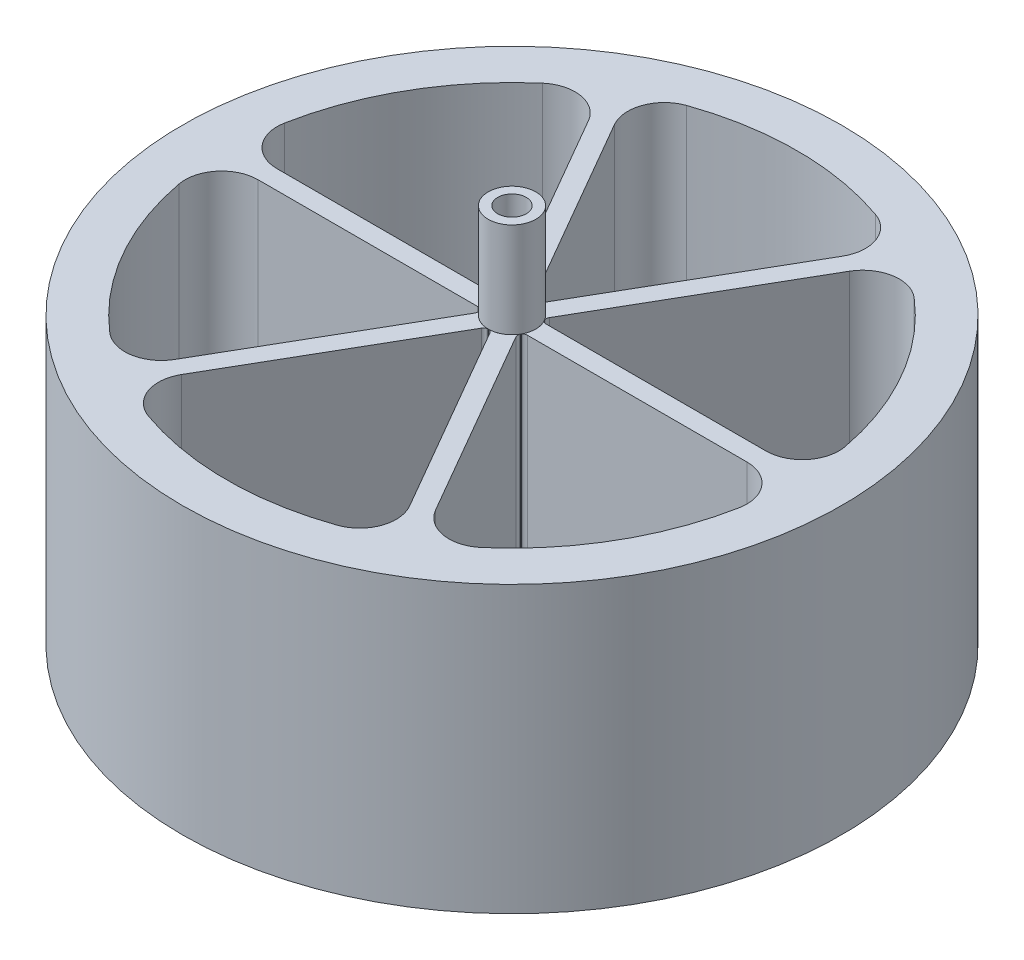
from build123d import *

# Parameters (mm, degrees)
SKETCH1_R             = 2.5
SKETCH1_R_2           = 1.5
BOSS_EXTRUDE1_DEPTH   = 10
BOSS_EXTRUDE3_DEPTH   = 30
BOSS_EXTRUDE3_2_DEPTH = 30
BOSS_EXTRUDE3_3_DEPTH = 30
BOSS_EXTRUDE3_4_DEPTH = 30
BOSS_EXTRUDE3_5_DEPTH = 30
BOSS_EXTRUDE3_6_DEPTH = 30
SKETCH5_R             = 34.666608733
SKETCH5_R_2           = 30
BOSS_EXTRUDE4_DEPTH   = 30
BOSS_EXTRUDE5_START   = -10
SKETCH6_R             = 1.5
BOSS_EXTRUDE5_DEPTH   = 10
SKETCH7_R             = 1.5
CUT_EXTRUDE1_DEPTH    = 9


with BuildPart() as part:
    # Sketch1 → Boss-Extrude1 (new body)
    with BuildSketch(Plane(origin=(0, 0, 0), x_dir=(1, 0, 0), z_dir=(0, 1, 0))):
        with Locations(Location((0, 0, 0), (0, 0, 270))):
            Circle(SKETCH1_R)
        with Locations(Location((0, 0, 0), (0, 0, 270))):
            Circle(SKETCH1_R_2, mode=Mode.SUBTRACT)
    extrude(amount=BOSS_EXTRUDE1_DEPTH)

    # Sketch6 → Boss-Extrude5 (add)
    with BuildSketch(Plane(origin=(0, 10, 0), x_dir=(1, 0, 0), z_dir=(0, 1, 0)).offset(BOSS_EXTRUDE5_START)):
        Circle(SKETCH6_R)
    extrude(amount=BOSS_EXTRUDE5_DEPTH)

    # Sketch7 → Cut-Extrude1 (cut)
    with BuildSketch(Plane(origin=(0, 10, 0), x_dir=(1, 0, 0), z_dir=(0, 1, 0))):
        with Locations(Location((0, 0, 0), (0, 0, 270))):
            Circle(SKETCH7_R)
    extrude(amount=-CUT_EXTRUDE1_DEPTH, mode=Mode.SUBTRACT)


with BuildPart() as body_2:
    # Sketch2 → Boss-Extrude3 (new body)
    with BuildSketch(Plane(origin=(0, 0, 0), x_dir=(-1, 0, 0), z_dir=(0, -1, 0))):
        with BuildLine():
            Line((2.61395079, 1), (25.707973339, 1))
            ThreePointArc((25.707973339, 1), (28.664062792, 2.388870469), (29.481986287, 5.550899437))
            ThreePointArc((29.481986287, 5.550899437), (30, 0), (29.481986287, -5.550899437))
            ThreePointArc((29.481986287, -5.550899437), (28.664062792, -2.388870469), (25.707973339, -1))
            Line((25.707973339, -1), (2.61395079, -1))
            ThreePointArc((2.61395079, -1), (2.399550586, -1.045528996), (2.222154945, -1.174257873))
            Line((2.222154945, -1.174257873), (2.178514499, -1.226407182))
            ThreePointArc((2.178514499, -1.226407182), (2.499969191, -0.012411485), (2.190584188, 1.204716114))
            Line((2.190584188, 1.204716114), (2.222154945, 1.174257873))
            ThreePointArc((2.222154945, 1.174257873), (2.399550586, 1.045528996), (2.61395079, 1))
        make_face()
    extrude(amount=BOSS_EXTRUDE3_DEPTH)



with BuildPart() as body_3:
    # Sketch2 → Boss-Extrude3 2 (new body)
    with BuildSketch(Plane(origin=(0, 0, 0), x_dir=(-1, 0, 0), z_dir=(0, -1, 0))):
        with BuildLine():
            Line((0.440949991, -2.763747789), (11.987961266, -22.763757991))
            ThreePointArc((11.987961266, -22.763757991), (12.263208883, -26.018241788), (9.933773217, -28.307598797))
            ThreePointArc((9.933773217, -28.307598797), (15, -25.980762114), (19.54821307, -22.75669936))
            ThreePointArc((19.54821307, -22.75669936), (16.400853909, -23.629371319), (13.720012073, -21.763757991))
            Line((13.720012073, -21.763757991), (2.173000799, -1.763747789))
            ThreePointArc((2.173000799, -1.763747789), (2.105229964, -1.555307267), (2.128014621, -1.337313697))
            Line((2.128014621, -1.337313697), (2.138606853, -1.294743499))
            ThreePointArc((2.138606853, -1.294743499), (1.239235934, -2.17124257), (0.027157474, -2.49985249))
            Line((0.027157474, -2.49985249), (0.094140324, -2.511571571))
            ThreePointArc((0.094140324, -2.511571571), (0.294320622, -2.600836263), (0.440949991, -2.763747789))
        make_face()
    extrude(amount=BOSS_EXTRUDE3_2_DEPTH)


with BuildPart() as body_4:
    # Sketch2 → Boss-Extrude3 3 (new body)
    with BuildSketch(Plane(origin=(0, 0, 0), x_dir=(-1, 0, 0), z_dir=(0, -1, 0))):
        with BuildLine():
            Line((-2.173000799, -1.763747789), (-13.720012073, -21.763757991))
            ThreePointArc((-13.720012073, -21.763757991), (-16.400853909, -23.629371319), (-19.54821307, -22.75669936))
            ThreePointArc((-19.54821307, -22.75669936), (-15, -25.980762114), (-9.933773217, -28.307598797))
            ThreePointArc((-9.933773217, -28.307598797), (-12.263208883, -26.018241788), (-11.987961266, -22.763757991))
            Line((-11.987961266, -22.763757991), (-0.440949991, -2.763747789))
            ThreePointArc((-0.440949991, -2.763747789), (-0.294320622, -2.600836263), (-0.094140324, -2.511571571))
            Line((-0.094140324, -2.511571571), (-0.051977335, -2.499459613))
            ThreePointArc((-0.051977335, -2.499459613), (-1.260733257, -2.158831086), (-2.151357025, -1.273445308))
            Line((-2.151357025, -1.273445308), (-2.128014621, -1.337313697))
            ThreePointArc((-2.128014621, -1.337313697), (-2.105229964, -1.555307267), (-2.173000799, -1.763747789))
        make_face()
    extrude(amount=BOSS_EXTRUDE3_3_DEPTH)


with BuildPart() as body_5:
    # Sketch2 → Boss-Extrude3 4 (new body)
    with BuildSketch(Plane(origin=(0, 0, 0), x_dir=(-1, 0, 0), z_dir=(0, -1, 0))):
        with BuildLine():
            Line((-2.61395079, 1), (-25.707973339, 1))
            ThreePointArc((-25.707973339, 1), (-28.664062792, 2.388870469), (-29.481986287, 5.550899437))
            ThreePointArc((-29.481986287, 5.550899437), (-30, 0), (-29.481986287, -5.550899437))
            ThreePointArc((-29.481986287, -5.550899437), (-28.664062792, -2.388870469), (-25.707973339, -1))
            Line((-25.707973339, -1), (-2.61395079, -1))
            ThreePointArc((-2.61395079, -1), (-2.399550586, -1.045528996), (-2.222154945, -1.174257873))
            Line((-2.222154945, -1.174257873), (-2.190584188, -1.204716114))
            ThreePointArc((-2.190584188, -1.204716114), (-2.499969191, 0.012411485), (-2.178514499, 1.226407182))
            Line((-2.178514499, 1.226407182), (-2.222154945, 1.174257873))
            ThreePointArc((-2.222154945, 1.174257873), (-2.399550586, 1.045528996), (-2.61395079, 1))
        make_face()
    extrude(amount=BOSS_EXTRUDE3_4_DEPTH)


with BuildPart() as body_6:
    # Sketch2 → Boss-Extrude3 5 (new body)
    with BuildSketch(Plane(origin=(0, 0, 0), x_dir=(-1, 0, 0), z_dir=(0, -1, 0))):
        with BuildLine():
            Line((-0.440949991, 2.763747789), (-11.987961266, 22.763757991))
            ThreePointArc((-11.987961266, 22.763757991), (-12.263208883, 26.018241788), (-9.933773217, 28.307598797))
            ThreePointArc((-9.933773217, 28.307598797), (-15, 25.980762114), (-19.54821307, 22.75669936))
            ThreePointArc((-19.54821307, 22.75669936), (-16.400853909, 23.629371319), (-13.720012073, 21.763757991))
            Line((-13.720012073, 21.763757991), (-2.173000799, 1.763747789))
            ThreePointArc((-2.173000799, 1.763747789), (-2.105229964, 1.555307267), (-2.128014621, 1.337313697))
            Line((-2.128014621, 1.337313697), (-2.138606853, 1.294743499))
            ThreePointArc((-2.138606853, 1.294743499), (-1.239235934, 2.17124257), (-0.027157474, 2.49985249))
            Line((-0.027157474, 2.49985249), (-0.094140324, 2.511571571))
            ThreePointArc((-0.094140324, 2.511571571), (-0.294320622, 2.600836263), (-0.440949991, 2.763747789))
        make_face()
    extrude(amount=BOSS_EXTRUDE3_5_DEPTH)


with BuildPart() as body_7:
    # Sketch2 → Boss-Extrude3 6 (new body)
    with BuildSketch(Plane(origin=(0, 0, 0), x_dir=(-1, 0, 0), z_dir=(0, -1, 0))):
        with BuildLine():
            Line((2.173000799, 1.763747789), (13.720012073, 21.763757991))
            ThreePointArc((13.720012073, 21.763757991), (16.400853909, 23.629371319), (19.54821307, 22.75669936))
            ThreePointArc((19.54821307, 22.75669936), (15, 25.980762114), (9.933773217, 28.307598797))
            ThreePointArc((9.933773217, 28.307598797), (12.263208883, 26.018241788), (11.987961266, 22.763757991))
            Line((11.987961266, 22.763757991), (0.440949991, 2.763747789))
            ThreePointArc((0.440949991, 2.763747789), (0.294320622, 2.600836263), (0.094140324, 2.511571571))
            Line((0.094140324, 2.511571571), (0.051977335, 2.499459613))
            ThreePointArc((0.051977335, 2.499459613), (1.260733257, 2.158831086), (2.151357025, 1.273445308))
            Line((2.151357025, 1.273445308), (2.128014621, 1.337313697))
            ThreePointArc((2.128014621, 1.337313697), (2.105229964, 1.555307267), (2.173000799, 1.763747789))
        make_face()
    extrude(amount=BOSS_EXTRUDE3_6_DEPTH)


with BuildPart() as body_2_1:
    add(body_2.part)

    add(body_3.part)  # Boss-Extrude4 merges body 3

    add(body_4.part)  # Boss-Extrude4 merges body 4

    add(body_5.part)  # Boss-Extrude4 merges body 5

    add(body_6.part)  # Boss-Extrude4 merges body 6

    add(body_7.part)  # Boss-Extrude4 merges body 7
    # Sketch5 → Boss-Extrude4 (add)
    with BuildSketch(Plane(origin=(0, -30, 0), x_dir=(-1, 0, 0), z_dir=(0, -1, 0))):
        with Locations(Location((0, 0, 0), (0, 0, 90))):
            Circle(SKETCH5_R)
        Circle(SKETCH5_R_2, mode=Mode.SUBTRACT)
    extrude(amount=-BOSS_EXTRUDE4_DEPTH)


solid = Compound([part.part, body_2_1.part])
